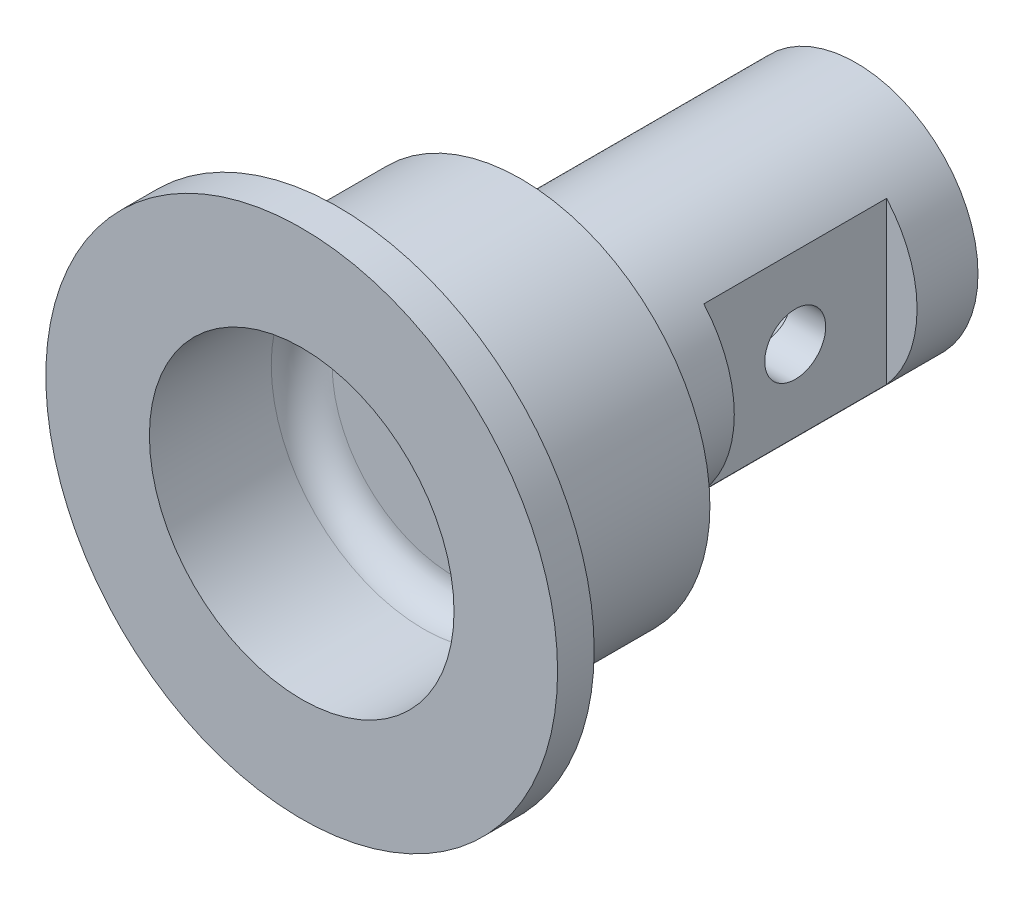
from build123d import *

# Parameters (mm, degrees)
REDONDEO1_R                            = 5
CORTAR_EXTRUIR1_REACH                  = 110.669
CORTAR_EXTRUIR1_END_RADIUS             = 20
CROQUIS2_W                             = 5
CROQUIS2_H                             = 30
CORTAR_EXTRUIR1_DIRECTION_2_REACH      = 110.669
CORTAR_EXTRUIR1_DIRECTION_2_END_RADIUS = 20
CORTAR_EXTRUIR3_REACH                  = 117.3
CORTAR_EXTRUIR3_END_RADIUS             = 9
CROQUIS3_R                             = 5


with BuildPart() as part:
    # Croquis1 → Revolución1 (revolve)
    with BuildSketch(Plane(origin=(0, 0, 0), x_dir=(1, 0, 0), z_dir=(0, 1, 0))):
        Polygon((25, 0), (42, 0), (42, 6), (31, 6), (31, 36), (20, 36), (20, 91), (9, 91), (9, 25), (25, 25), align=None)
    revolve(axis=Axis((0, 0, 3.677633668), (0, 0, -1)))

    # Redondeo1
    redondeo1_edges = [part.edges().sort_by_distance(p)[0] for p in [
        (-25, 0, -25),
        (-20, 0, -36),
        (-31, 0, -6),
    ]]
    fillet(redondeo1_edges, radius=REDONDEO1_R)

    # Cortar-Extruir1: up to this cylinder (the profile starts inside it)
    cortar_extruir1_end = Plane(origin=(0, 0, -66), z_dir=(0, 0, 1)) * Cylinder(CORTAR_EXTRUIR1_END_RADIUS, 262.338, mode=Mode.PRIVATE)
    # Croquis2 → Cortar-Extruir1 (cut, up to the surface)
    with BuildSketch(Plane(origin=(0, 0, 0), x_dir=(1, 0, 0), z_dir=(0, 1, 0)), mode=Mode.PRIVATE) as cortar_extruir1_sk1:
        with Locations((17.5, 66)):
            Rectangle(CROQUIS2_W, CROQUIS2_H)
    cortar_extruir1_tool1 = extrude(cortar_extruir1_sk1.sketch, amount=-CORTAR_EXTRUIR1_REACH, mode=Mode.PRIVATE) & cortar_extruir1_end
    cortar_extruir1 = cortar_extruir1_tool1.solids().sort_by_distance((17.5, 0, -66))[0]
    add(cortar_extruir1, mode=Mode.SUBTRACT)

    # Cortar-Extruir1 direction 2: up to this cylinder (the profile starts inside it)
    cortar_extruir1_direction_2_end = Plane(origin=(0, 0, -66), z_dir=(0, 0, 1)) * Cylinder(CORTAR_EXTRUIR1_DIRECTION_2_END_RADIUS, 262.338, mode=Mode.PRIVATE)
    # Croquis2 → Cortar-Extruir1 direction 2 (cut, up to the surface)
    with BuildSketch(Plane(origin=(0, 0, 0), x_dir=(1, 0, 0), z_dir=(0, 1, 0)), mode=Mode.PRIVATE) as cortar_extruir1_direction_2_sk1:
        with Locations((17.5, 66)):
            Rectangle(CROQUIS2_W, CROQUIS2_H)
    cortar_extruir1_direction_2_tool1 = extrude(cortar_extruir1_direction_2_sk1.sketch, amount=CORTAR_EXTRUIR1_DIRECTION_2_REACH, mode=Mode.PRIVATE) & cortar_extruir1_direction_2_end
    cortar_extruir1_direction_2 = cortar_extruir1_direction_2_tool1.solids().sort_by_distance((17.5, 0, -66))[0]
    add(cortar_extruir1_direction_2, mode=Mode.SUBTRACT)
    cortar_extruir1 = cortar_extruir1 + cortar_extruir1_direction_2  # both directions under the feature's name, for the pattern or mirror that repeats it

    # Cortar-Extruir3: up to this cylinder (the profile starts outside it)
    cortar_extruir3_end = Plane(origin=(0, 0, -66), z_dir=(0, 0, 1)) * Cylinder(CORTAR_EXTRUIR3_END_RADIUS, 253.6, mode=Mode.PRIVATE)
    # Croquis3 → Cortar-Extruir3 (cut, up to the surface)
    with BuildSketch(Plane(origin=(15, 0, 0), x_dir=(0, 0, -1), z_dir=(1, 0, 0)), mode=Mode.PRIVATE) as cortar_extruir3_sk1:
        with Locations((66, 0)):
            Circle(CROQUIS3_R)
    cortar_extruir3_tool1 = extrude(cortar_extruir3_sk1.sketch, amount=-CORTAR_EXTRUIR3_REACH, mode=Mode.PRIVATE) - cortar_extruir3_end
    cortar_extruir3 = cortar_extruir3_tool1.solids().sort_by_distance((15, 0, -66))[0]
    add(cortar_extruir3, mode=Mode.SUBTRACT)

    # Simetría2: Cortar-Extruir1, Cortar-Extruir3 across plane
    add(cortar_extruir1.mirror(Plane(origin=(0, 0, 0), x_dir=(0, 0, 1), z_dir=(1, 0, 0))), mode=Mode.SUBTRACT)
    add(cortar_extruir3.mirror(Plane(origin=(0, 0, 0), x_dir=(0, 0, 1), z_dir=(1, 0, 0))), mode=Mode.SUBTRACT)


solid = part.part
